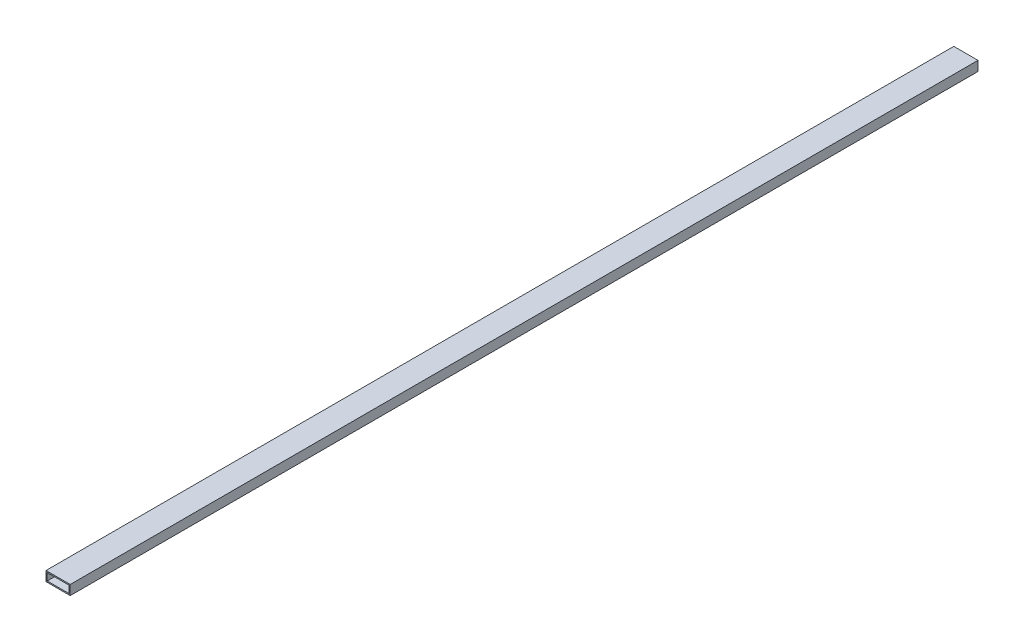
from build123d import *

# Parameters (mm, degrees)
SKETCH_1_W      = 20
SKETCH_1_H      = 8
SKETCH_1_W_2    = 18
SKETCH_1_H_2    = 6
EXTRUDE_1_DEPTH = 375


with BuildPart() as part:
    # 草图1 → 凸台-拉伸1 (new, symmetric)
    with BuildSketch(Plane.XY):
        Rectangle(SKETCH_1_W, SKETCH_1_H)
        Rectangle(SKETCH_1_W_2, SKETCH_1_H_2, mode=Mode.SUBTRACT)
    extrude(amount=EXTRUDE_1_DEPTH, both=True)


solid = part.part
